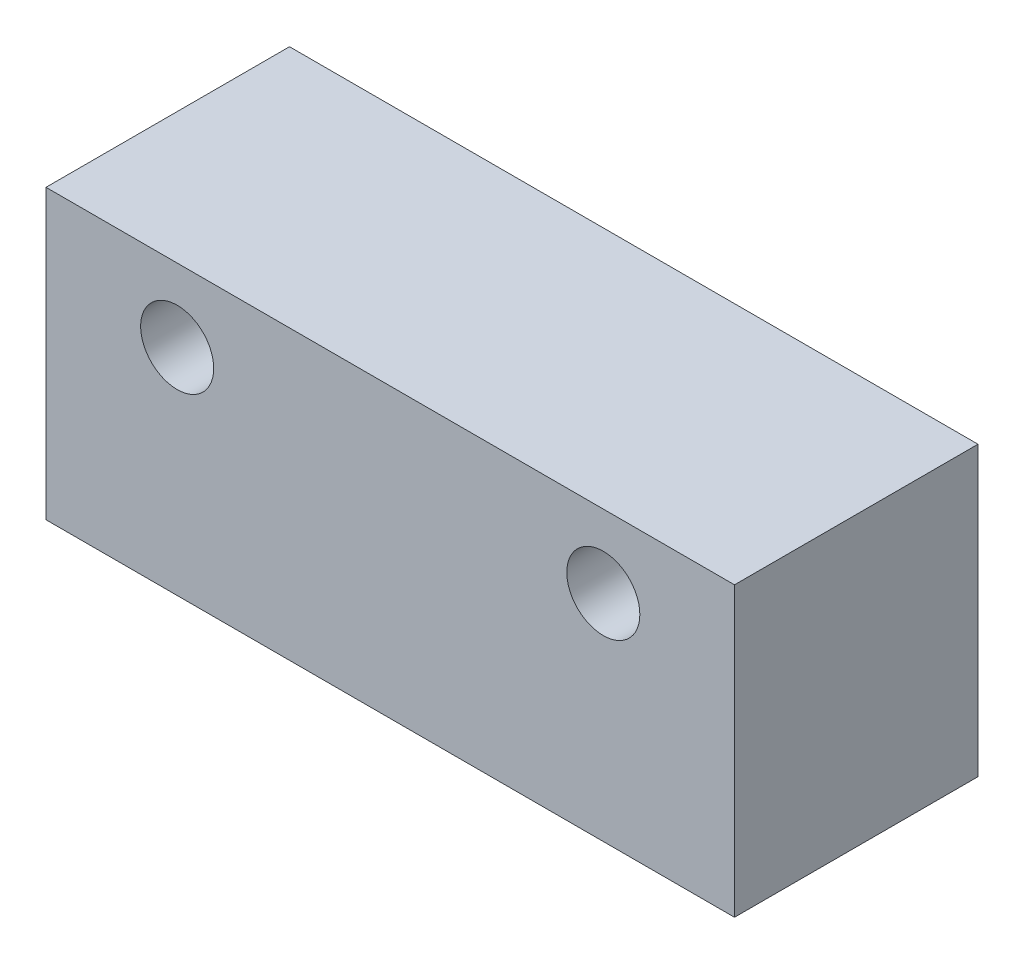
from build123d import *

# Parameters (mm, degrees)
SKETCH1_W           = 56.55
SKETCH1_H           = 23.65
BOSS_EXTRUDE1_DEPTH = 20
CUT_EXTRUDE1_DEPTH  = 12


with BuildPart() as part:
    # Sketch1 → Boss-Extrude1 (new body)
    with BuildSketch(Plane.XY):
        Rectangle(SKETCH1_W, SKETCH1_H)
    extrude(amount=BOSS_EXTRUDE1_DEPTH)

    # Sketch2 → Cut-Extrude1 (cut)
    with BuildSketch(Plane.XY.offset(20)):
        with BuildLine():
            Line((-20.5, 5.825), (-17.5, 5.825))
            Line((-17.5, 5.825), (-14.5, 5.825))
            ThreePointArc((-14.5, 5.825), (-17.5, 8.825), (-20.5, 5.825))
        make_face()
        with BuildLine():
            Line((-14.5, 5.825), (-17.5, 5.825))
            Line((-17.5, 5.825), (-20.5, 5.825))
            ThreePointArc((-20.5, 5.825), (-17.5, 2.825), (-14.5, 5.825))
        make_face()
        with BuildLine():
            ThreePointArc((20.5, 5.825), (17.5, 8.825), (14.5, 5.825))
            Line((14.5, 5.825), (17.5, 5.825))
            Line((17.5, 5.825), (20.5, 5.825))
        make_face()
        with BuildLine():
            Line((17.5, 5.825), (14.5, 5.825))
            ThreePointArc((14.5, 5.825), (17.5, 2.825), (20.5, 5.825))
            Line((20.5, 5.825), (17.5, 5.825))
        make_face()
    extrude(amount=-CUT_EXTRUDE1_DEPTH, mode=Mode.SUBTRACT)


solid = part.part
